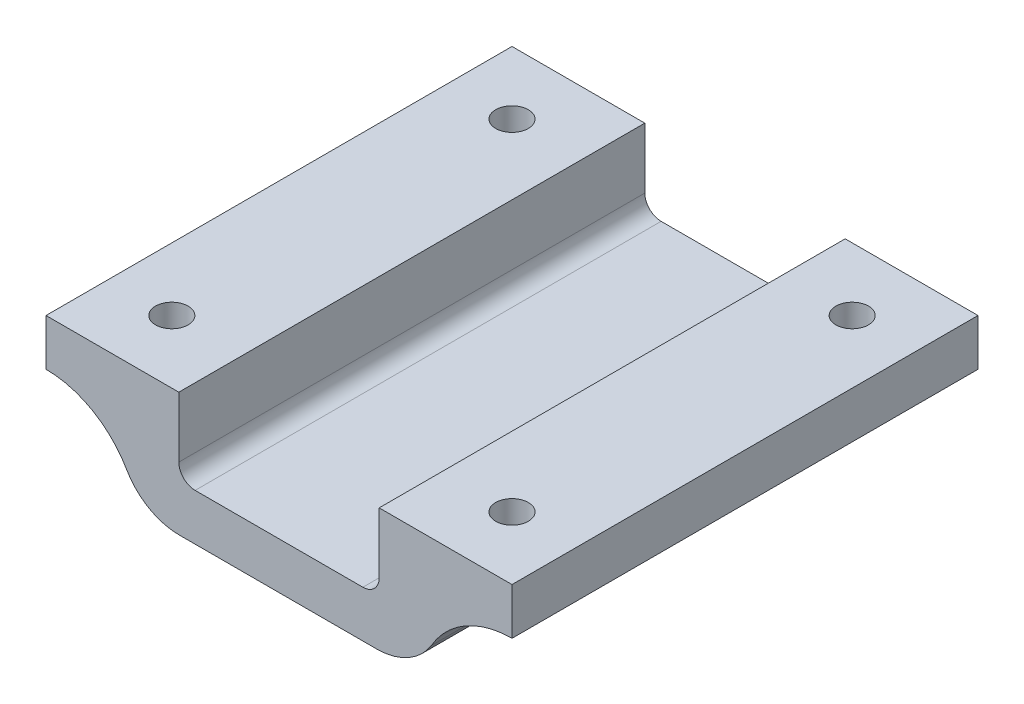
from build123d import *

# Parameters (mm, degrees)
BOSS_EXTRUDE1_DEPTH = 50
SKETCH2_R           = 1.75
CUT_EXTRUDE1_DEPTH  = 72.941382389
CUT_EXTRUDE2_DEPTH  = 8.249997


with BuildPart() as part:
    # Sketch1 → Boss-Extrude1 (new body)
    with BuildSketch(Plane.XY):
        with BuildLine():
            Line((50, 10.224622738), (50, 5.224622738))
            ThreePointArc((50, 5.224622738), (45, 3.884876776), (41.339745962, 0.224622738))
            ThreePointArc((41.339745962, 0.224622738), (38.927083678, -2.096523604), (35.710580838, -3.025377262))
            Line((35.710580838, -3.025377262), (14.289419162, -3.025377262))
            ThreePointArc((14.289419162, -3.025377262), (11.039419162, -2.154542386), (8.660254038, 0.224622738))
            ThreePointArc((8.660254038, 0.224622738), (5, 3.884876776), (0, 5.224622738))
            Line((0, 5.224622738), (0, 10.224622738))
            Line((0, 10.224622738), (14.25, 10.224622738))
            Line((14.25, 10.224622738), (14.25, 3.724622738))
            ThreePointArc((14.25, 3.724622738), (14.762563133, 2.487185871), (16, 1.974622738))
            Line((16, 1.974622738), (34, 1.974622738))
            ThreePointArc((34, 1.974622738), (35.237436867, 2.487185871), (35.75, 3.724622738))
            Line((35.75, 3.724622738), (35.75, 10.224622738))
            Line((35.75, 10.224622738), (50, 10.224622738))
        make_face()
    extrude(amount=-BOSS_EXTRUDE1_DEPTH)

    # Sketch2 → Cut-Extrude1 (cut, through all)
    with BuildSketch(Plane.XZ.offset(3.025377262)):
        with Locations(Location((6.75, -43.25, 0), (0, 0, 270))):
            Circle(SKETCH2_R)
        with Locations(Location((43.25, -43.25, 0), (0, 0, 270))):
            Circle(SKETCH2_R)
        with Locations(Location((6.75, -6.75, 0), (0, 0, 270))):
            Circle(SKETCH2_R)
        with Locations(Location((43.25, -6.75, 0), (0, 0, 270))):
            Circle(SKETCH2_R)
    extrude(amount=-CUT_EXTRUDE1_DEPTH, mode=Mode.SUBTRACT)

    # Sketch3 → Cut-Extrude2 (cut)
    with BuildSketch(Plane.XZ.offset(3.025377262)):
        Polygon((9.75, -5.017949192), (6.75, -3.285898385), (3.75, -5.017949192), (3.75, -8.482050808), (6.75, -10.214101615), (9.75, -8.482050808), align=None)
        Polygon((6.770844829, -39.785961101), (3.760476728, -41.499928399), (3.739631899, -44.963967298), (6.729155171, -46.714038899), (9.739523272, -45.000071601), (9.760368101, -41.536032702), align=None)
        Polygon((40.239631899, -41.536032702), (43.229155171, -39.785961101), (46.239523272, -41.499928399), (46.260368101, -44.963967298), (43.270844829, -46.714038899), (40.260476728, -45.000071601), align=None)
        Polygon((40.25, -8.482050808), (40.25, -5.017949192), (43.25, -3.285898385), (46.25, -5.017949192), (46.25, -8.482050808), (43.25, -10.214101615), align=None)
    extrude(amount=-CUT_EXTRUDE2_DEPTH, mode=Mode.SUBTRACT)


solid = part.part
